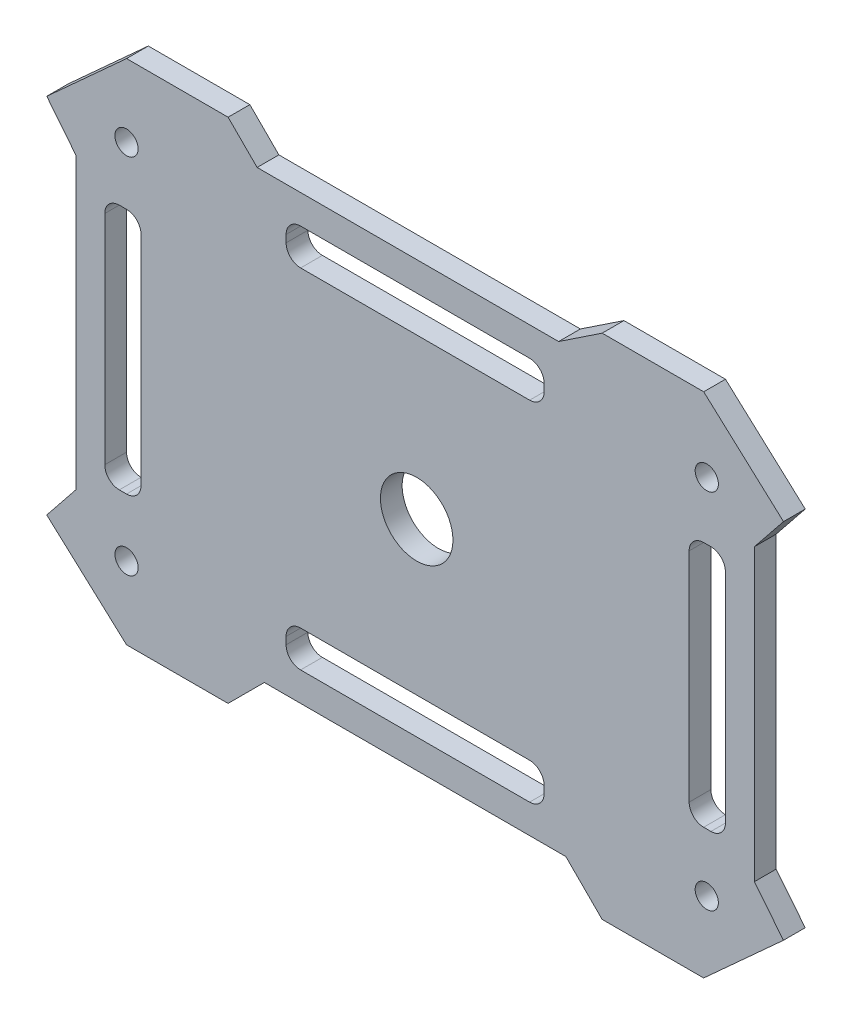
from build123d import *

# Parameters (mm, degrees)
SKETCH1_R           = 5
SKETCH1_R_2         = 1.6
BOSS_EXTRUDE1_DEPTH = 3


with BuildPart() as part:
    # Sketch1 → Boss-Extrude1 (new body)
    with BuildSketch(Plane.XY):
        Polygon((-45.543251899, 37.858976545), (-34.543251899, 47.858976545), (-20.543251899, 47.858976545), (-16.543251899, 43.858976545), (25.031099214, 43.858976545), (31.03073365, 47.858976545), (45.03073365, 47.858976545), (56.03073365, 37.858976545), (52.022363456, 32.858976545), (52.022363456, -7.141022754), (56.022363456, -12.141022754), (45.022363456, -22.141023455), (31.022363456, -22.141023455), (26.022026899, -17.141023456), (-15.547636545, -17.141023456), (-20.547636544, -22.141023455), (-34.547636544, -22.141023455), (-45.547636544, -12.141023262), (-41.547636544, -7.141023263), (-41.547636544, 32.858976545), align=None)
        with Locations((5.4567481, 12.858976545)):
            Circle(SKETCH1_R, mode=Mode.SUBTRACT)
        with Locations((-34.547636544, 37.858976545)):
            Circle(SKETCH1_R_2, mode=Mode.SUBTRACT)
        with Locations((45.452363456, 37.858977252)):
            Circle(SKETCH1_R_2, mode=Mode.SUBTRACT)
        with Locations((45.452363456, -12.141022748)):
            Circle(SKETCH1_R_2, mode=Mode.SUBTRACT)
        with Locations((-34.547636544, -12.141023262)):
            Circle(SKETCH1_R_2, mode=Mode.SUBTRACT)
        with BuildLine():
            Line((-35.547636544, 29.858976545), (-34.547636544, 29.858976545))
            ThreePointArc((-34.547636544, 29.858976545), (-33.133422981, 29.273190108), (-32.547636544, 27.858976545))
            Line((-32.547636544, 27.858976545), (-32.547636544, -2.141023455))
            ThreePointArc((-32.547636544, -2.141023455), (-33.133422981, -3.555237017), (-34.547636544, -4.141023455))
            Line((-34.547636544, -4.141023455), (-35.547636544, -4.141023455))
            ThreePointArc((-35.547636544, -4.141023455), (-36.961850106, -3.555237017), (-37.547636544, -2.141023455))
            Line((-37.547636544, -2.141023455), (-37.547636544, 27.858976545))
            ThreePointArc((-37.547636544, 27.858976545), (-36.961850106, 29.273190108), (-35.547636544, 29.858976545))
        make_face(mode=Mode.SUBTRACT)
        with BuildLine():
            Line((-10.5432519, 39.858976545), (21.03073365, 39.858976545))
            ThreePointArc((21.03073365, 39.858976545), (22.444947212, 39.273190108), (23.03073365, 37.858976545))
            Line((23.03073365, 37.858976545), (23.03073365, 36.858976545))
            ThreePointArc((23.03073365, 36.858976545), (22.444947212, 35.444762983), (21.03073365, 34.858976545))
            Line((21.03073365, 34.858976545), (-10.5432519, 34.858976545))
            ThreePointArc((-10.5432519, 34.858976545), (-11.957465462, 35.444762983), (-12.5432519, 36.858976545))
            Line((-12.5432519, 36.858976545), (-12.5432519, 37.858976545))
            ThreePointArc((-12.5432519, 37.858976545), (-11.957465462, 39.273190108), (-10.5432519, 39.858976545))
        make_face(mode=Mode.SUBTRACT)
        with BuildLine():
            Line((46.022363456, 29.858976545), (45.022363456, 29.858976545))
            ThreePointArc((45.022363456, 29.858976545), (43.608149894, 29.273190108), (43.022363456, 27.858976545))
            Line((43.022363456, 27.858976545), (43.022363456, -2.141023455))
            ThreePointArc((43.022363456, -2.141023455), (43.608149894, -3.555237017), (45.022363456, -4.141023455))
            Line((45.022363456, -4.141023455), (46.022363456, -4.141023455))
            ThreePointArc((46.022363456, -4.141023455), (47.436577019, -3.555237017), (48.022363456, -2.141023455))
            Line((48.022363456, -2.141023455), (48.022363456, 27.858976545))
            ThreePointArc((48.022363456, 27.858976545), (47.436577019, 29.273190108), (46.022363456, 29.858976545))
        make_face(mode=Mode.SUBTRACT)
        with BuildLine():
            Line((21.022363456, -13.141023456), (-10.547636544, -13.141023456))
            ThreePointArc((-10.547636544, -13.141023456), (-11.961850106, -12.555237019), (-12.547636544, -11.141023456))
            Line((-12.547636544, -11.141023456), (-12.547636544, -10.141023456))
            ThreePointArc((-12.547636544, -10.141023456), (-11.961850106, -8.726809894), (-10.547636544, -8.141023456))
            Line((-10.547636544, -8.141023456), (21.022363456, -8.141023456))
            ThreePointArc((21.022363456, -8.141023456), (22.436577019, -8.726809894), (23.022363456, -10.141023456))
            Line((23.022363456, -10.141023456), (23.022363456, -11.141023456))
            ThreePointArc((23.022363456, -11.141023456), (22.436577019, -12.555237019), (21.022363456, -13.141023456))
        make_face(mode=Mode.SUBTRACT)
    extrude(amount=BOSS_EXTRUDE1_DEPTH)


solid = part.part
